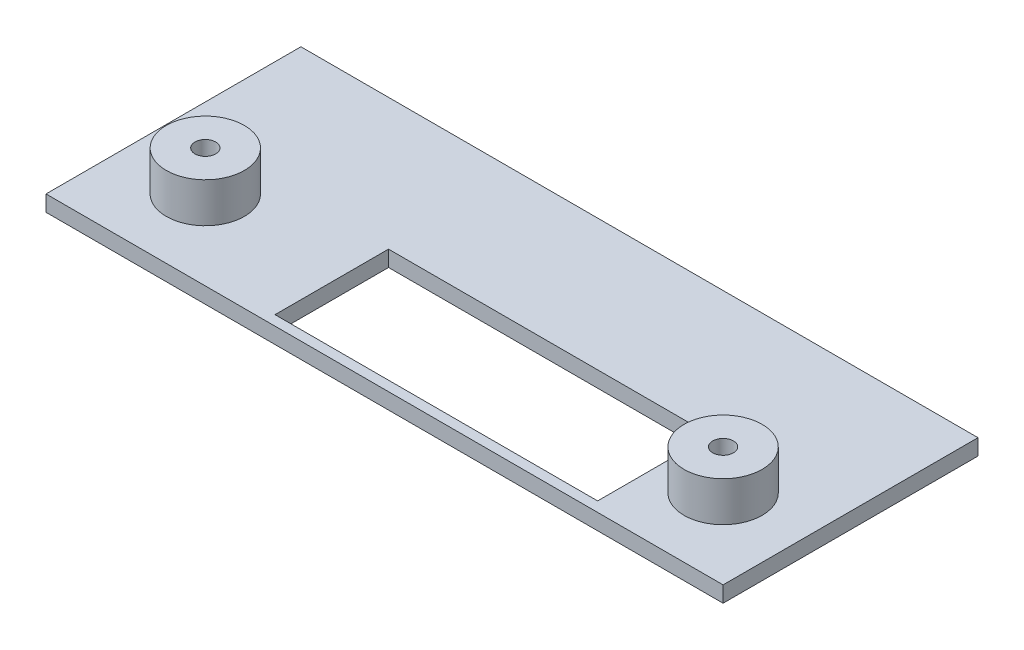
from build123d import *

# Parameters (mm, degrees)
SKETCH1_W             = 170
SKETCH1_H             = 64
SKETCH1_R             = 10
SKETCH1_W_2           = 81
SKETCH1_H_2           = 28.5
BOSS_EXTRUDE1_DEPTH   = 4
BOSS_EXTRUDE2_START   = -4
SKETCH2_R             = 10
SKETCH2_R_2           = 9.8
BOSS_EXTRUDE2_DEPTH   = 4
SKETCH3_R             = 9.8
BOSS_EXTRUDE3_DEPTH   = 10
BOSS_EXTRUDE3_2_DEPTH = 10
BOSS_EXTRUDE4_START   = 4
SKETCH4_R             = 9.8
SKETCH4_R_2           = 2.6
BOSS_EXTRUDE4_DEPTH   = 4
SKETCH5_R             = 2.6
CUT_EXTRUDE1_DEPTH    = 47


with BuildPart() as part:
    # Sketch1 → Boss-Extrude1 (new body)
    with BuildSketch(Plane(origin=(0, 0, 0), x_dir=(1, 0, 0), z_dir=(0, 1, 0))):
        with Locations((85, 32)):
            Rectangle(SKETCH1_W, SKETCH1_H)
        with Locations(Location((20, 20, 0), (0, 0, 270))):
            Circle(SKETCH1_R, mode=Mode.SUBTRACT)
        with Locations(Location((150, 20, 0), (0, 0, 270))):
            Circle(SKETCH1_R, mode=Mode.SUBTRACT)
        with Locations((95.5, 16.75)):
            Rectangle(SKETCH1_W_2, SKETCH1_H_2, mode=Mode.SUBTRACT)
    extrude(amount=BOSS_EXTRUDE1_DEPTH)

    # Sketch2 → Boss-Extrude2 (add)
    # profile 1 of 2: a face of its own
    with BuildSketch(Plane(origin=(0, 4, 0), x_dir=(1, 0, 0), z_dir=(0, 1, 0)).offset(BOSS_EXTRUDE2_START)):
        with Locations((20, 20)):
            Circle(SKETCH2_R)
        with Locations(Location((20, 20, 0), (0, 0, 270))):
            Circle(SKETCH2_R_2, mode=Mode.SUBTRACT)
    # profile 2 of 2: a face of its own
    with BuildSketch(Plane(origin=(0, 4, 0), x_dir=(1, 0, 0), z_dir=(0, 1, 0)).offset(BOSS_EXTRUDE2_START)):
        with Locations((150, 20)):
            Circle(SKETCH2_R)
        with Locations(Location((150, 20, 0), (0, 0, 270))):
            Circle(SKETCH2_R_2, mode=Mode.SUBTRACT)
    extrude(amount=BOSS_EXTRUDE2_DEPTH)



with BuildPart() as body_2:
    # Sketch3 → Boss-Extrude3 (new body)
    with BuildSketch(Plane(origin=(0, 4, 0), x_dir=(1, 0, 0), z_dir=(0, 1, 0))):
        with Locations(Location((20, 20, 0), (0, 0, 270))):
            Circle(SKETCH3_R)
    extrude(amount=BOSS_EXTRUDE3_DEPTH)


with BuildPart() as body_3:
    # Sketch3 → Boss-Extrude3 2 (new body)
    with BuildSketch(Plane(origin=(0, 4, 0), x_dir=(1, 0, 0), z_dir=(0, 1, 0))):
        with Locations(Location((150, 20, 0), (0, 0, 270))):
            Circle(SKETCH3_R)
    extrude(amount=BOSS_EXTRUDE3_2_DEPTH)


with BuildPart() as part_1:
    add(part.part)

    add(body_2.part)  # Boss-Extrude4 merges body 2

    add(body_3.part)  # Boss-Extrude4 merges body 3
    # Sketch4 → Boss-Extrude4 (add)
    # profile 1 of 4: a face of its own
    with BuildSketch(Plane.XZ.offset(-4).offset(BOSS_EXTRUDE4_START)):
        with Locations(Location((20, -20, 0), (0, 0, 90))):
            Circle(SKETCH4_R)
        Polygon((25.25388745, -20), (22.626943725, -15.45), (17.373056275, -15.45), (14.74611255, -20), (17.373056275, -24.55), (22.626943725, -24.55), align=None, mode=Mode.SUBTRACT)
    # profile 2 of 4: a face of its own
    with BuildSketch(Plane.XZ.offset(-4).offset(BOSS_EXTRUDE4_START)):
        with Locations(Location((20, -20, 0), (0, 0, 90))):
            Circle(SKETCH4_R_2)
    # profile 3 of 4: a face of its own
    with BuildSketch(Plane.XZ.offset(-4).offset(BOSS_EXTRUDE4_START)):
        with Locations(Location((150, -20, 0), (0, 0, 90))):
            Circle(SKETCH4_R)
        Polygon((155.25388745, -20), (152.626943725, -15.45), (147.373056275, -15.45), (144.74611255, -20), (147.373056275, -24.55), (152.626943725, -24.55), align=None, mode=Mode.SUBTRACT)
    # profile 4 of 4: a face of its own
    with BuildSketch(Plane.XZ.offset(-4).offset(BOSS_EXTRUDE4_START)):
        with Locations(Location((150, -20, 0), (0, 0, 90))):
            Circle(SKETCH4_R_2)
    extrude(amount=-BOSS_EXTRUDE4_DEPTH)

    # Sketch5 → Cut-Extrude1 (cut)
    with BuildSketch(Plane.XZ):
        with Locations(Location((20, -20, 0), (0, 0, 90))):
            Circle(SKETCH5_R)
        with Locations(Location((150, -20, 0), (0, 0, 90))):
            Circle(SKETCH5_R)
    extrude(amount=-CUT_EXTRUDE1_DEPTH, mode=Mode.SUBTRACT)


solid = part_1.part
